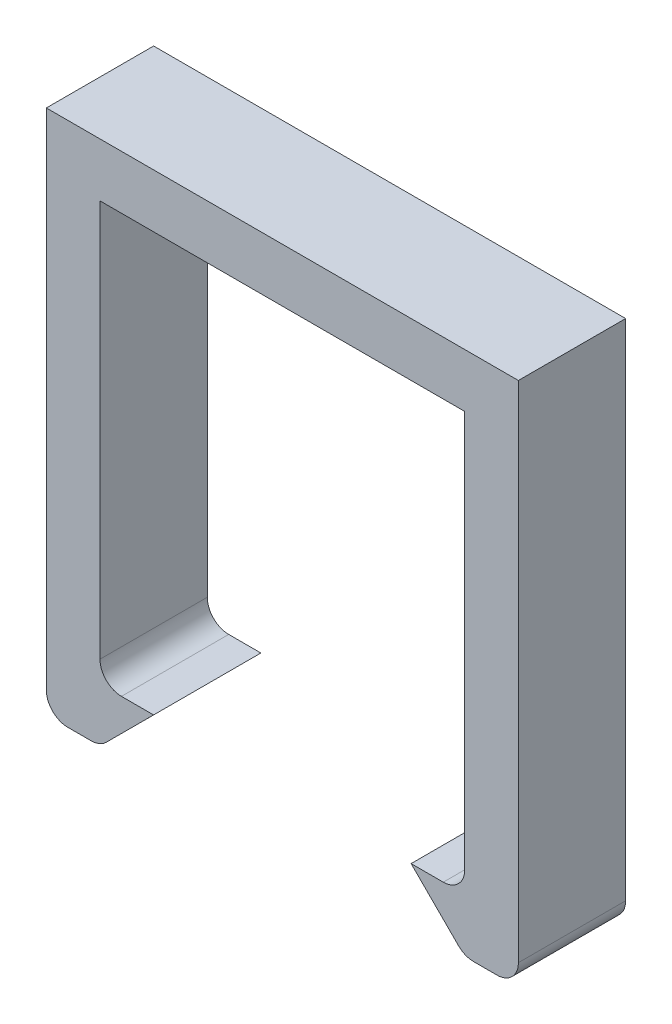
from build123d import *

# Parameters (mm, degrees)
BOSS_EXTRUDE1_DEPTH = 12.7


with BuildPart() as part:
    # Sketch2 → Boss-Extrude1 (new body)
    with BuildSketch(Plane.XY):
        with BuildLine():
            Line((0, 0), (49.530251281, 0))
            Line((49.530251281, 0), (49.530251281, -59.689999999))
            ThreePointArc((49.530251281, -59.689999999), (48.786302505, -61.486051224), (46.990251281, -62.229999999))
            Line((46.990251281, -62.229999999), (44.232383169, -62.229999999))
            ThreePointArc((44.232383169, -62.229999999), (43.260344035, -62.036644396), (42.436296408, -61.486015686))
            Line((42.436296408, -61.486015686), (36.830502562, -55.879999999))
            Line((36.830502562, -55.879999999), (40.640502562, -55.879999999))
            ThreePointArc((40.640502562, -55.879999999), (42.436553786, -55.136051224), (43.180502562, -53.339999999))
            Line((43.180502562, -53.339999999), (43.180502562, -6.35))
            Line((43.180502562, -6.35), (0, -6.35))
            Line((0, -6.35), (0, -53.339999999))
            ThreePointArc((0, -53.339999999), (0.743948776, -55.136051224), (2.54, -55.879999999))
            Line((2.54, -55.879999999), (6.35, -55.879999999))
            Line((6.35, -55.879999999), (0.744206153, -61.486015686))
            ThreePointArc((0.744206153, -61.486015686), (-0.079841474, -62.036644396), (-1.051880608, -62.229999999))
            Line((-1.051880608, -62.229999999), (-3.809748719, -62.229999999))
            ThreePointArc((-3.809748719, -62.229999999), (-5.605799943, -61.486051224), (-6.349748719, -59.689999999))
            Line((-6.349748719, -59.689999999), (-6.349748719, 0))
            Line((-6.349748719, 0), (0, 0))
        make_face()
    extrude(amount=BOSS_EXTRUDE1_DEPTH)


solid = part.part
